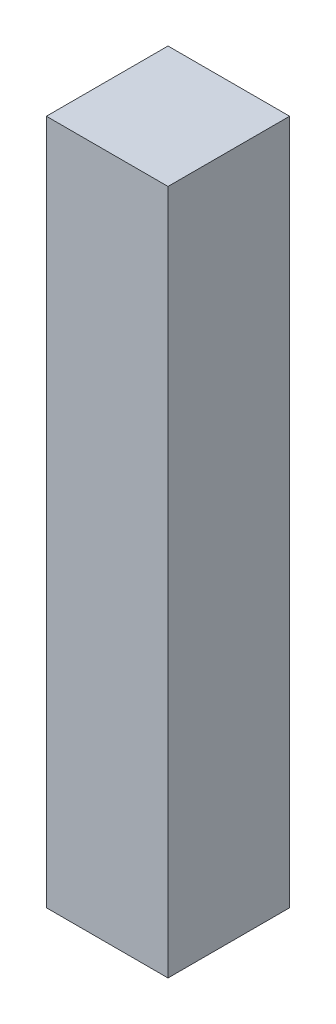
from build123d import *

# Parameters (mm, degrees)
SKETCH_1_W      = 5.5
SKETCH_1_H      = 31
EXTRUDE_1_DEPTH = 5.5


with BuildPart() as part:
    # ｽｹｯﾁ1 → ﾎﾞｽ - 押し出し1 (new body)
    with BuildSketch(Plane.XY):
        Rectangle(SKETCH_1_W, SKETCH_1_H)
    extrude(amount=EXTRUDE_1_DEPTH)


solid = part.part
